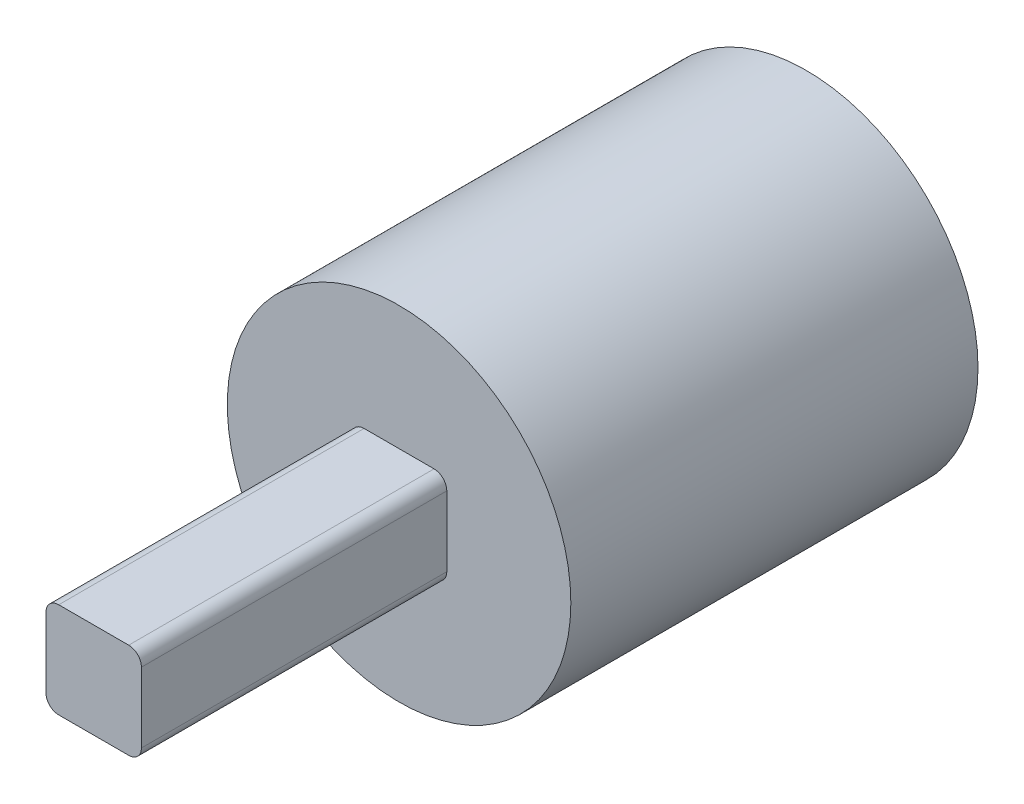
from build123d import *

# Parameters (mm, degrees)
SKETCH1_R           = 13.5
BOSS_EXTRUDE1_DEPTH = 32
BOSS_EXTRUDE2_DEPTH = 24


with BuildPart() as part:
    # Sketch1 → Boss-Extrude1 (new body)
    with BuildSketch(Plane.XY):
        Circle(SKETCH1_R)
    extrude(amount=BOSS_EXTRUDE1_DEPTH)

    # Sketch2 → Boss-Extrude2 (add)
    with BuildSketch(Plane.XY.offset(32)):
        with BuildLine():
            Line((-2.75, -3.75), (2.75, -3.75))
            ThreePointArc((2.75, -3.75), (3.457106781, -3.457106781), (3.75, -2.75))
            Line((3.75, -2.75), (3.75, 2.75))
            ThreePointArc((3.75, 2.75), (3.457106781, 3.457106781), (2.75, 3.75))
            Line((2.75, 3.75), (-2.75, 3.75))
            ThreePointArc((-2.75, 3.75), (-3.457106781, 3.457106781), (-3.75, 2.75))
            Line((-3.75, 2.75), (-3.75, -2.75))
            ThreePointArc((-3.75, -2.75), (-3.457106781, -3.457106781), (-2.75, -3.75))
        make_face()
    extrude(amount=BOSS_EXTRUDE2_DEPTH)


solid = part.part
